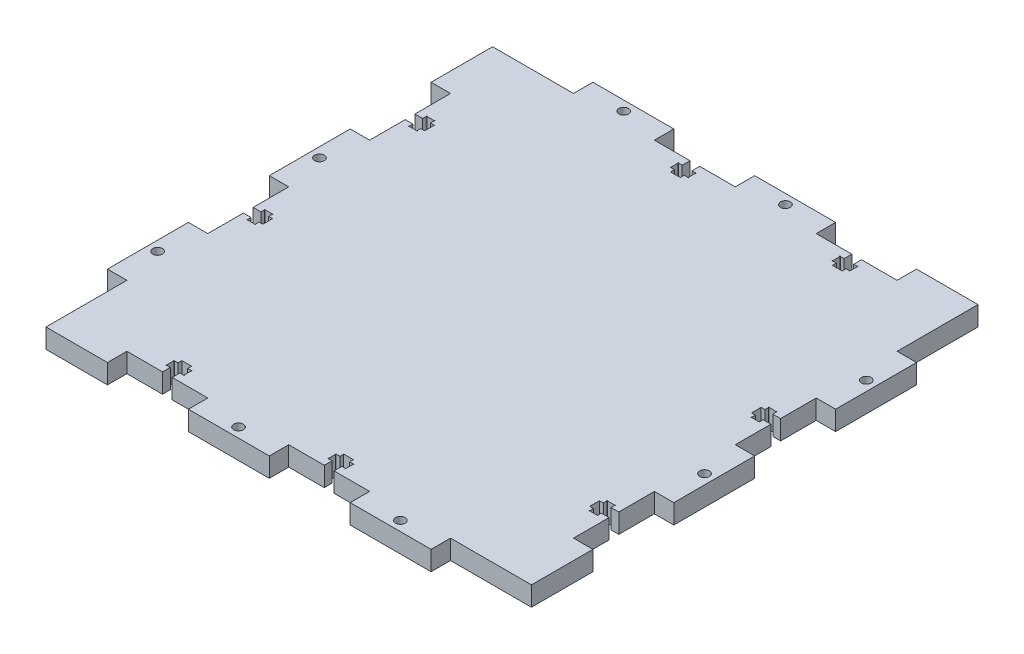
from build123d import *

# Parameters (mm, degrees)
BOSS_EXTRUDE1_DEPTH = 6
SKETCH2_R           = 1.5
CUT_EXTRUDE1_DEPTH  = 107.235587258


with BuildPart() as part:
    # Sketch1 → Boss-Extrude1 (new body)
    with BuildSketch(Plane(origin=(0, 0, 0), x_dir=(1, 0, 0), z_dir=(0, 1, 0))):
        Polygon((0, 75), (25, 75), (25, 69), (50, 69), (50, 75), (69, 75), (69, 50), (75, 50), (75, 25), (69, 25), (69, 0), (75, 0), (75, -25), (69, -25), (69, -50), (75, -50), (75, -69), (50, -69), (50, -75), (25, -75), (25, -69), (0, -69), (0, -75), (-25, -75), (-25, -69), (-50, -69), (-50, -75), (-69, -75), (-69, -50), (-75, -50), (-75, -25), (-69, -25), (-69, 0), (-75, 0), (-75, 25), (-69, 25), (-69, 50), (-75, 50), (-75, 69), (-50, 69), (-50, 75), (-25, 75), (-25, 69), (0, 69), align=None)
    extrude(amount=BOSS_EXTRUDE1_DEPTH)

    # Sketch2 → Cut-Extrude1 (cut, through all)
    with BuildSketch(Plane(origin=(0, 6, 0), x_dir=(1, 0, 0), z_dir=(0, 1, 0))):
        with Locations(Location((-37.5, 72, 0), (0, 0, 270))):
            Circle(SKETCH2_R)
        with Locations(Location((12.5, 72, 0), (0, 0, 270))):
            Circle(SKETCH2_R)
        with Locations(Location((72, 37.5, 0), (0, 0, 270))):
            Circle(SKETCH2_R)
        with Locations(Location((72, -12.5, 0), (0, 0, 270))):
            Circle(SKETCH2_R)
        with Locations(Location((37.5, -72, 0), (0, 0, 270))):
            Circle(SKETCH2_R)
        with Locations(Location((-12.5, -72, 0), (0, 0, 270))):
            Circle(SKETCH2_R)
        with Locations(Location((-72, -37.5, 0), (0, 0, 270))):
            Circle(SKETCH2_R)
        with Locations(Location((-72, 12.5, 0), (0, 0, 270))):
            Circle(SKETCH2_R)
        with BuildLine():
            Line((-11, 69), (-14, 69))
            Line((-14, 69), (-14, 66.6))
            Line((-14, 66.6), (-15.1, 66.6))
            ThreePointArc((-15.1, 66.6), (-15.270710678, 66.670710678), (-15.2, 66.5))
            Line((-15.2, 66.5), (-15.2, 64.3))
            ThreePointArc((-15.2, 64.3), (-15.270710678, 64.129289322), (-15.1, 64.2))
            Line((-15.1, 64.2), (-14, 64.2))
            Line((-14, 64.2), (-14, 63))
            Line((-14, 63), (-11, 63))
            Line((-11, 63), (-11, 64.2))
            Line((-11, 64.2), (-9.9, 64.2))
            ThreePointArc((-9.9, 64.2), (-9.729289322, 64.129289322), (-9.8, 64.3))
            Line((-9.8, 64.3), (-9.8, 66.5))
            ThreePointArc((-9.8, 66.5), (-9.729289322, 66.670710678), (-9.9, 66.6))
            Line((-9.9, 66.6), (-11, 66.6))
            Line((-11, 66.6), (-11, 69))
        make_face()
        with BuildLine():
            Line((69, 11), (69, 14))
            Line((69, 14), (66.6, 14))
            Line((66.6, 14), (66.6, 15.1))
            ThreePointArc((66.6, 15.1), (66.670710678, 15.270710678), (66.5, 15.2))
            Line((66.5, 15.2), (64.3, 15.2))
            ThreePointArc((64.3, 15.2), (64.129289322, 15.270710678), (64.2, 15.1))
            Line((64.2, 15.1), (64.2, 14))
            Line((64.2, 14), (63, 14))
            Line((63, 14), (63, 11))
            Line((63, 11), (64.2, 11))
            Line((64.2, 11), (64.2, 9.9))
            ThreePointArc((64.2, 9.9), (64.129289322, 9.729289322), (64.3, 9.8))
            Line((64.3, 9.8), (66.5, 9.8))
            ThreePointArc((66.5, 9.8), (66.670710678, 9.729289322), (66.6, 9.9))
            Line((66.6, 9.9), (66.6, 11))
            Line((66.6, 11), (69, 11))
        make_face()
        with BuildLine():
            Line((39, 69), (36, 69))
            Line((36, 69), (36, 66.6))
            Line((36, 66.6), (34.9, 66.6))
            ThreePointArc((34.9, 66.6), (34.729289322, 66.670710678), (34.8, 66.5))
            Line((34.8, 66.5), (34.8, 64.3))
            ThreePointArc((34.8, 64.3), (34.729289322, 64.129289322), (34.9, 64.2))
            Line((34.9, 64.2), (36, 64.2))
            Line((36, 64.2), (36, 63))
            Line((36, 63), (39, 63))
            Line((39, 63), (39, 64.2))
            Line((39, 64.2), (40.1, 64.2))
            ThreePointArc((40.1, 64.2), (40.270710678, 64.129289322), (40.2, 64.3))
            Line((40.2, 64.3), (40.2, 66.5))
            ThreePointArc((40.2, 66.5), (40.270710678, 66.670710678), (40.1, 66.6))
            Line((40.1, 66.6), (39, 66.6))
            Line((39, 66.6), (39, 69))
        make_face()
        with BuildLine():
            Line((69, -39), (69, -36))
            Line((69, -36), (66.6, -36))
            Line((66.6, -36), (66.6, -34.9))
            ThreePointArc((66.6, -34.9), (66.670710678, -34.729289322), (66.5, -34.8))
            Line((66.5, -34.8), (64.3, -34.8))
            ThreePointArc((64.3, -34.8), (64.129289322, -34.729289322), (64.2, -34.9))
            Line((64.2, -34.9), (64.2, -36))
            Line((64.2, -36), (63, -36))
            Line((63, -36), (63, -39))
            Line((63, -39), (64.2, -39))
            Line((64.2, -39), (64.2, -40.1))
            ThreePointArc((64.2, -40.1), (64.129289322, -40.270710678), (64.3, -40.2))
            Line((64.3, -40.2), (66.5, -40.2))
            ThreePointArc((66.5, -40.2), (66.670710678, -40.270710678), (66.6, -40.1))
            Line((66.6, -40.1), (66.6, -39))
            Line((66.6, -39), (69, -39))
        make_face()
        with BuildLine():
            Line((11, -69), (14, -69))
            Line((14, -69), (14, -66.6))
            Line((14, -66.6), (15.1, -66.6))
            ThreePointArc((15.1, -66.6), (15.270710678, -66.670710678), (15.2, -66.5))
            Line((15.2, -66.5), (15.2, -64.3))
            ThreePointArc((15.2, -64.3), (15.270710678, -64.129289322), (15.1, -64.2))
            Line((15.1, -64.2), (14, -64.2))
            Line((14, -64.2), (14, -63))
            Line((14, -63), (11, -63))
            Line((11, -63), (11, -64.2))
            Line((11, -64.2), (9.9, -64.2))
            ThreePointArc((9.9, -64.2), (9.729289322, -64.129289322), (9.8, -64.3))
            Line((9.8, -64.3), (9.8, -66.5))
            ThreePointArc((9.8, -66.5), (9.729289322, -66.670710678), (9.9, -66.6))
            Line((9.9, -66.6), (11, -66.6))
            Line((11, -66.6), (11, -69))
        make_face()
        with BuildLine():
            Line((-39, -69), (-36, -69))
            Line((-36, -69), (-36, -66.6))
            Line((-36, -66.6), (-34.9, -66.6))
            ThreePointArc((-34.9, -66.6), (-34.729289322, -66.670710678), (-34.8, -66.5))
            Line((-34.8, -66.5), (-34.8, -64.3))
            ThreePointArc((-34.8, -64.3), (-34.729289322, -64.129289322), (-34.9, -64.2))
            Line((-34.9, -64.2), (-36, -64.2))
            Line((-36, -64.2), (-36, -63))
            Line((-36, -63), (-39, -63))
            Line((-39, -63), (-39, -64.2))
            Line((-39, -64.2), (-40.1, -64.2))
            ThreePointArc((-40.1, -64.2), (-40.270710678, -64.129289322), (-40.2, -64.3))
            Line((-40.2, -64.3), (-40.2, -66.5))
            ThreePointArc((-40.2, -66.5), (-40.270710678, -66.670710678), (-40.1, -66.6))
            Line((-40.1, -66.6), (-39, -66.6))
            Line((-39, -66.6), (-39, -69))
        make_face()
        with BuildLine():
            Line((-69, 39), (-69, 36))
            Line((-69, 36), (-66.6, 36))
            Line((-66.6, 36), (-66.6, 34.9))
            ThreePointArc((-66.6, 34.9), (-66.670710678, 34.729289322), (-66.5, 34.8))
            Line((-66.5, 34.8), (-64.3, 34.8))
            ThreePointArc((-64.3, 34.8), (-64.129289322, 34.729289322), (-64.2, 34.9))
            Line((-64.2, 34.9), (-64.2, 36))
            Line((-64.2, 36), (-63, 36))
            Line((-63, 36), (-63, 39))
            Line((-63, 39), (-64.2, 39))
            Line((-64.2, 39), (-64.2, 40.1))
            ThreePointArc((-64.2, 40.1), (-64.129289322, 40.270710678), (-64.3, 40.2))
            Line((-64.3, 40.2), (-66.5, 40.2))
            ThreePointArc((-66.5, 40.2), (-66.670710678, 40.270710678), (-66.6, 40.1))
            Line((-66.6, 40.1), (-66.6, 39))
            Line((-66.6, 39), (-69, 39))
        make_face()
        with BuildLine():
            Line((-69, -11), (-69, -14))
            Line((-69, -14), (-66.6, -14))
            Line((-66.6, -14), (-66.6, -15.1))
            ThreePointArc((-66.6, -15.1), (-66.670710678, -15.270710678), (-66.5, -15.2))
            Line((-66.5, -15.2), (-64.3, -15.2))
            ThreePointArc((-64.3, -15.2), (-64.129289322, -15.270710678), (-64.2, -15.1))
            Line((-64.2, -15.1), (-64.2, -14))
            Line((-64.2, -14), (-63, -14))
            Line((-63, -14), (-63, -11))
            Line((-63, -11), (-64.2, -11))
            Line((-64.2, -11), (-64.2, -9.9))
            ThreePointArc((-64.2, -9.9), (-64.129289322, -9.729289322), (-64.3, -9.8))
            Line((-64.3, -9.8), (-66.5, -9.8))
            ThreePointArc((-66.5, -9.8), (-66.670710678, -9.729289322), (-66.6, -9.9))
            Line((-66.6, -9.9), (-66.6, -11))
            Line((-66.6, -11), (-69, -11))
        make_face()
    extrude(amount=-CUT_EXTRUDE1_DEPTH, mode=Mode.SUBTRACT)


solid = part.part
